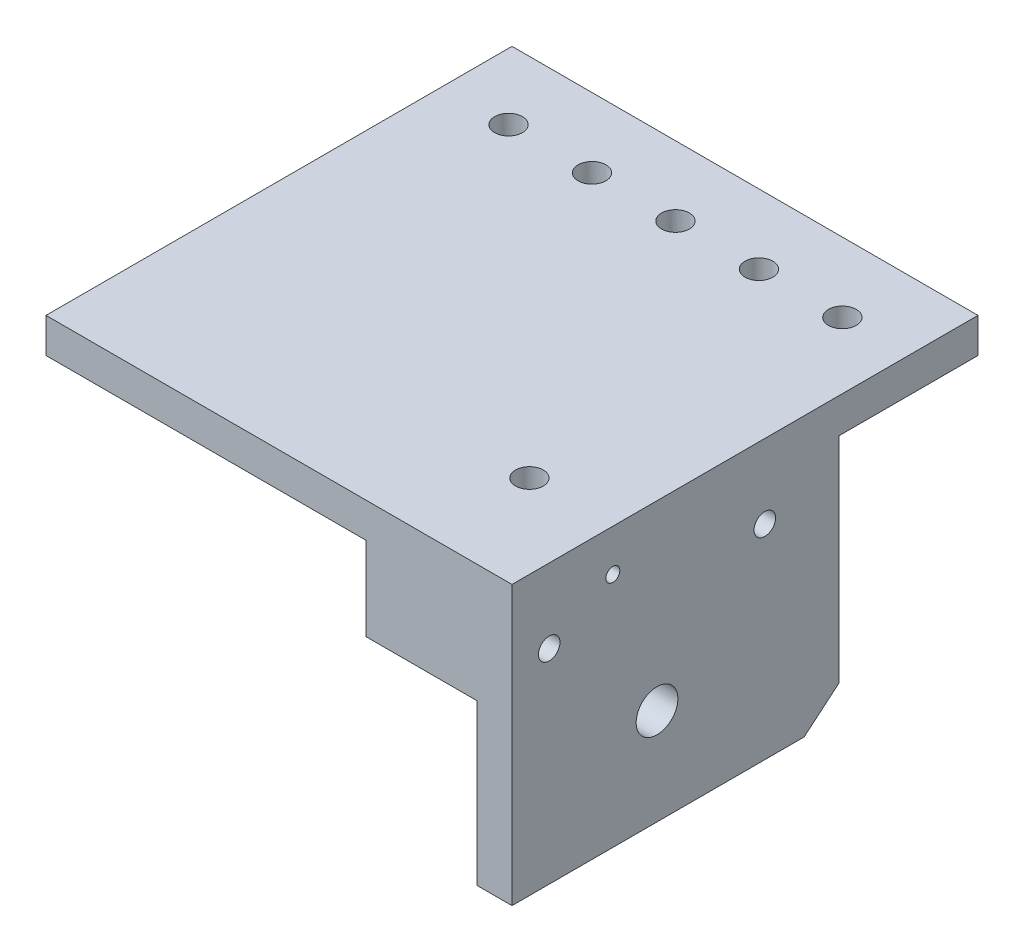
from build123d import *

# Parameters (mm, degrees)
BOSS_EXTRUDE1_DEPTH = 50
BOSS_EXTRUDE2_DEPTH = 12
BOSS_EXTRUDE3_DEPTH = 5
SKETCH5_W           = 16
SKETCH5_H           = 12
BOSS_EXTRUDE4_DEPTH = 42
SKETCH6_R           = 3
CUT_EXTRUDE1_DEPTH  = 92.449439583
CUT_EXTRUDE2_START  = 14
SKETCH7_R           = 12
CUT_EXTRUDE2_DEPTH  = 74.852148522
SKETCH8_R           = 1.55
CUT_EXTRUDE3_DEPTH  = 92.449439583
SKETCH9_R           = 1.5
CUT_EXTRUDE4_DEPTH  = 42
SKETCH10_R          = 2
CUT_EXTRUDE5_DEPTH  = 10
SKETCH11_R          = 1
CUT_EXTRUDE6_DEPTH  = 92.449439583
SKETCH12_R          = 2
CUT_EXTRUDE7_DEPTH  = 10
SKETCH13_R          = 2
CUT_EXTRUDE8_DEPTH  = 10


with BuildPart() as part:
    # Sketch1 → Boss-Extrude1 (new body)
    with BuildSketch(Plane(origin=(0, 0, 0), x_dir=(0, 0, -1), z_dir=(1, 0, 0))):
        Polygon((-15, 15), (-15, -25), (-10, -20.804501844), (-10, -10), (-10, 10), (10, 10), (10, 15), align=None)
    extrude(amount=BOSS_EXTRUDE1_DEPTH)

    # Sketch2 → Boss-Extrude2 (add)
    with BuildSketch(Plane(origin=(50, 0, 0), x_dir=(0, 0, -1), z_dir=(1, 0, 0))):
        Polygon((-15, 15), (-15, -11.945927107), (-10, -7.750428951), (-10, 10), (10, 10), (10, 15), align=None)
    extrude(amount=BOSS_EXTRUDE2_DEPTH)

    # Sketch4 → Boss-Extrude3 (add)
    with BuildSketch(Plane(origin=(62, 0, 0), x_dir=(0, 0, -1), z_dir=(1, 0, 0))):
        Polygon((10, 15), (-15, 15), (-15, -11.945927107), (-10, -7.750428951), (-10, 10), (10, 10), align=None)
        Polygon((-15, -25), (-10, -20.804501844), (-10, -7.750428951), (-15, -11.945927107), align=None)
    extrude(amount=BOSS_EXTRUDE3_DEPTH)

    # Sketch5 → Boss-Extrude4 (add)
    with BuildSketch(Plane.XY.offset(15)):
        Polygon((67, 15), (0, 15), (0, 10), (46, 10), (62, 10), (67, 10), align=None)
        with Locations((54, 4)):
            Rectangle(SKETCH5_W, SKETCH5_H)
        Polygon((67, -25), (67, 10), (62, 10), (62, -2), (62, -11.945927107), (62, -25), align=None)
    extrude(amount=BOSS_EXTRUDE4_DEPTH)

    # Sketch6 → Cut-Extrude1 (cut, through all)
    with BuildSketch(Plane(origin=(67, 0, 0), x_dir=(0, 0, -1), z_dir=(1, 0, 0))):
        with Locations((-36.15, -11.15)):
            Circle(SKETCH6_R)
    extrude(amount=-CUT_EXTRUDE1_DEPTH, mode=Mode.SUBTRACT)

    # Sketch7 → Cut-Extrude2 (cut, through all)
    with BuildSketch(Plane.ZY.offset(-62).offset(CUT_EXTRUDE2_START)):
        with Locations((36.15, -11.15)):
            Circle(SKETCH7_R)
    extrude(amount=CUT_EXTRUDE2_DEPTH, mode=Mode.SUBTRACT)

    # Sketch8 → Cut-Extrude3 (cut, through all)
    with BuildSketch(Plane(origin=(67, 0, 0), x_dir=(0, 0, -1), z_dir=(1, 0, 0))):
        with Locations((-51.65, 4.35)):
            Circle(SKETCH8_R)
        with Locations((-20.65, 4.35)):
            Circle(SKETCH8_R)
    extrude(amount=-CUT_EXTRUDE3_DEPTH, mode=Mode.SUBTRACT)

    # Sketch9 → Cut-Extrude4 (cut)
    with BuildSketch(Plane(origin=(0, 15, 0), x_dir=(1, 0, 0), z_dir=(0, 1, 0))):
        with Locations(Location((55, -42.5, 0), (0, 0, 270))):
            Circle(SKETCH9_R)
    extrude(amount=-CUT_EXTRUDE4_DEPTH, mode=Mode.SUBTRACT)

    # Sketch10 → Cut-Extrude5 (cut)
    with BuildSketch(Plane(origin=(0, 15, 0), x_dir=(1, 0, 0), z_dir=(0, 1, 0))):
        with Locations(Location((55, -42.5, 0), (0, 0, 270))):
            Circle(SKETCH10_R)
    extrude(amount=-CUT_EXTRUDE5_DEPTH, mode=Mode.SUBTRACT)

    # Sketch11 → Cut-Extrude6 (cut, through all)
    with BuildSketch(Plane(origin=(67, 0, 0), x_dir=(0, 0, -1), z_dir=(1, 0, 0))):
        with Locations((-42.5, 9)):
            Circle(SKETCH11_R)
    extrude(amount=-CUT_EXTRUDE6_DEPTH, mode=Mode.SUBTRACT)

    # Sketch12 → Cut-Extrude7 (cut)
    with BuildSketch(Plane(origin=(0, 15, 0), x_dir=(1, 0, 0), z_dir=(0, 1, 0))):
        with Locations(Location((9.5, 0, 0), (0, 0, 270))):
            Circle(SKETCH12_R)
        with Locations(Location((21.5, 0, 0), (0, 0, 270))):
            Circle(SKETCH12_R)
        with Locations(Location((33.5, 0, 0), (0, 0, 270))):
            Circle(SKETCH12_R)
        with Locations(Location((45.5, 0, 0), (0, 0, 270))):
            Circle(SKETCH12_R)
        with Locations(Location((57.5, 0, 0), (0, 0, 270))):
            Circle(SKETCH12_R)
    extrude(amount=-CUT_EXTRUDE7_DEPTH, mode=Mode.SUBTRACT)

    # Sketch13 → Cut-Extrude8 (cut)
    with BuildSketch(Plane(origin=(0, 0, 10), x_dir=(-1, 0, 0), z_dir=(0, 0, -1))):
        with Locations((-5, 0)):
            Circle(SKETCH13_R)
        with Locations((-16, 0)):
            Circle(SKETCH13_R)
        with Locations((-27, 0)):
            Circle(SKETCH13_R)
    extrude(amount=-CUT_EXTRUDE8_DEPTH, mode=Mode.SUBTRACT)


solid = part.part
